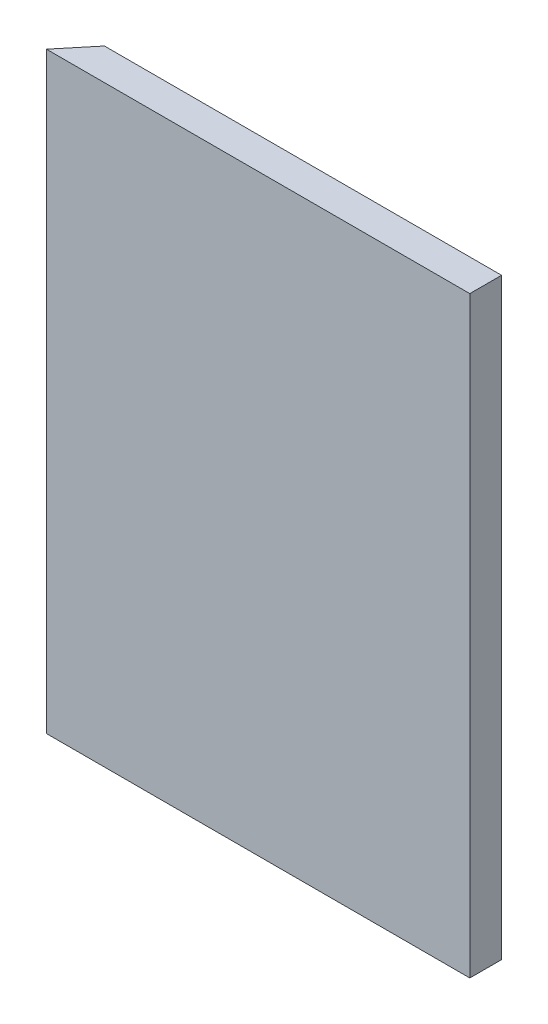
from build123d import *

# Parameters (mm, degrees)
SKETCH1_W           = 10
SKETCH1_H           = 0.75
BOSS_EXTRUDE1_DEPTH = 14
CUT_EXTRUDE1_DEPTH  = 16.443445211


with BuildPart() as part:
    # Sketch1 → Boss-Extrude1 (new body)
    with BuildSketch(Plane(origin=(0, 0, 0), x_dir=(1, 0, 0), z_dir=(0, 1, 0))):
        with Locations((-1.5, -0.125)):
            Rectangle(SKETCH1_W, SKETCH1_H)
    extrude(amount=BOSS_EXTRUDE1_DEPTH)

    # Sketch2 → Cut-Extrude1 (cut, through all)
    with BuildSketch(Plane(origin=(0, 14, 0), x_dir=(1, 0, 0), z_dir=(0, 1, 0))):
        Polygon((-6.5, -0.5), (-5.879697265, 0.25), (-6.5, 0.25), align=None)
    extrude(amount=-CUT_EXTRUDE1_DEPTH, mode=Mode.SUBTRACT)


solid = part.part
